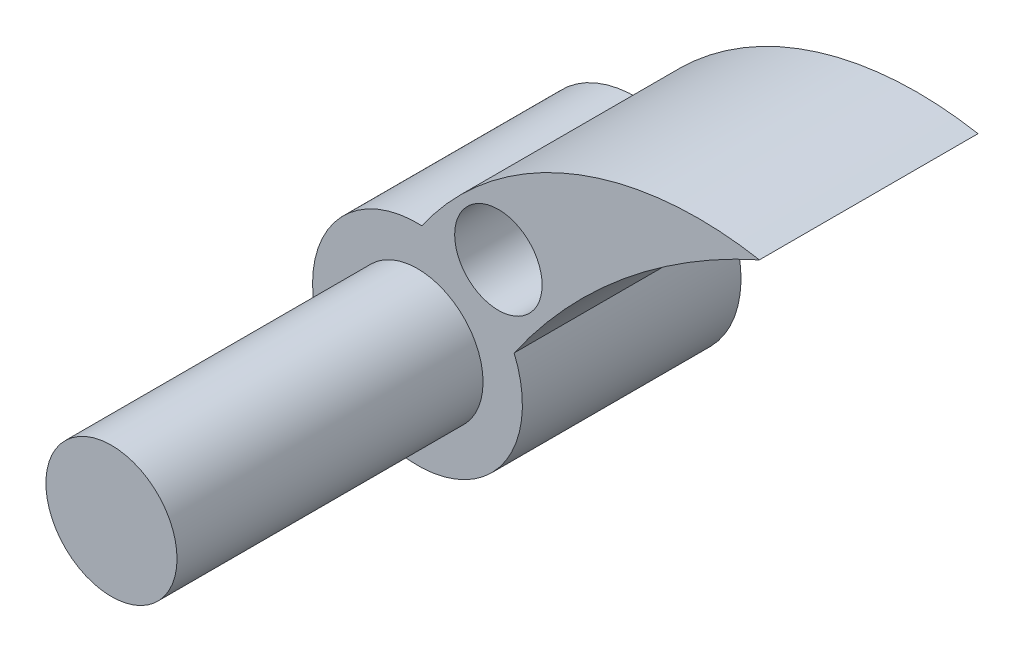
from build123d import *

# Parameters (mm, degrees)
BOSS_EXTRUDE1_DEPTH = 5
SKETCH2_R           = 1.5
BOSS_EXTRUDE2_DEPTH = 7
SKETCH4_R           = 1
CUT_EXTRUDE1_DEPTH  = 21.732622043


with BuildPart() as part:
    # Sketch1 → Boss-Extrude1 (new body)
    with BuildSketch(Plane.XY):
        with BuildLine():
            ThreePointArc((12.735353306, 10.993667304), (8.407166921, 10.537476108), (5.016332041, 7.809189722))
            ThreePointArc((5.016332041, 7.809189722), (3.545099052, 3.440082341), (7.125107355, 6.34476242))
            ThreePointArc((7.125107355, 6.34476242), (9.612326684, 9.052857395), (12.735353306, 10.993667304))
        make_face()
    extrude(amount=BOSS_EXTRUDE1_DEPTH)

    # Sketch2 → Boss-Extrude2 (add)
    with BuildSketch(Plane.XY.offset(5)):
        with Locations((4.914048995, 5.411370258)):
            Circle(SKETCH2_R)
    extrude(amount=BOSS_EXTRUDE2_DEPTH)

    # Sketch4 → Cut-Extrude1 (cut, through all)
    with BuildSketch(Plane(origin=(0, 0, 0), x_dir=(-1, 0, 0), z_dir=(0, 0, -1))):
        with Locations((-6.764513076, 8.009147455)):
            Circle(SKETCH4_R)
    extrude(amount=-CUT_EXTRUDE1_DEPTH, mode=Mode.SUBTRACT)


solid = part.part
